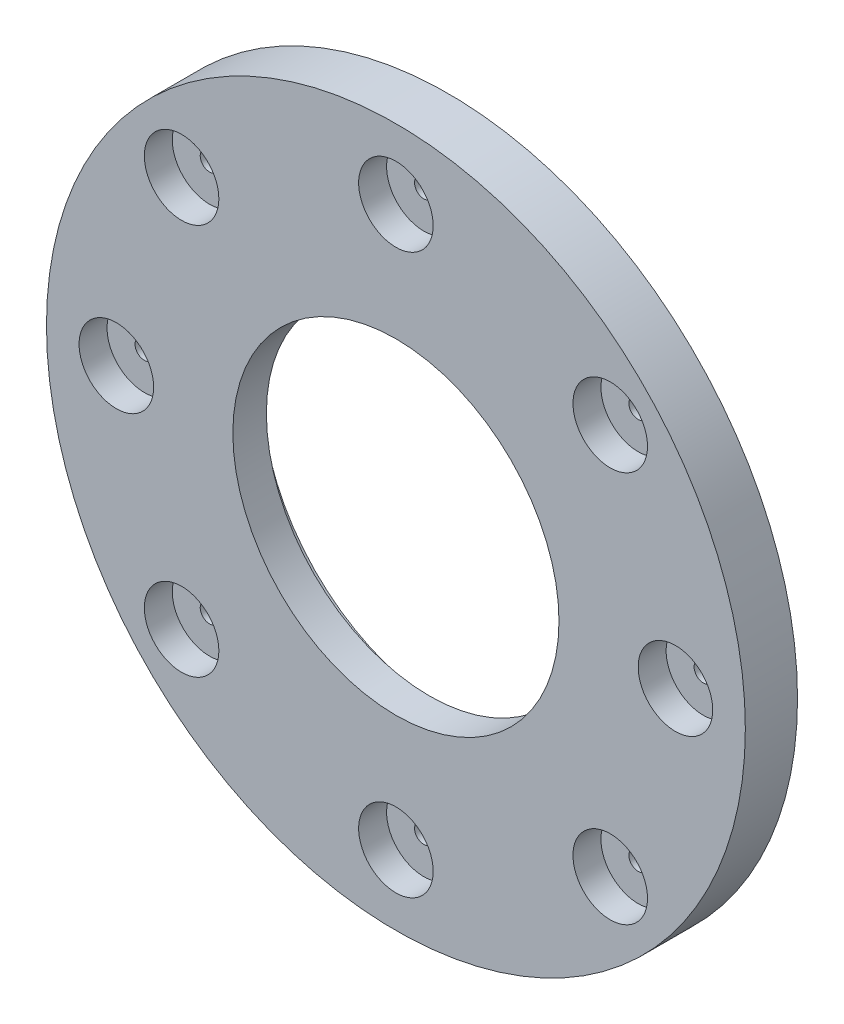
from build123d import *

# Parameters (mm, degrees)
SKETCH_1_R      = 37.5
SKETCH_1_R_2    = 20
SKETCH_1_R_3    = 1
EXTRUDE_1_DEPTH = 2
SKETCH_2_R      = 37.5
SKETCH_2_R_2    = 17.5
SKETCH_2_R_3    = 1
EXTRUDE_2_DEPTH = 0.6
SKETCH_3_R      = 37.5
SKETCH_3_R_2    = 17.5
SKETCH_3_R_3    = 4
EXTRUDE_3_DEPTH = 3


with BuildPart() as part:
    # Эскиз1 → Бобышка-Вытянуть1 (new body)
    with BuildSketch(Plane.XY):
        Circle(SKETCH_1_R)
        Circle(SKETCH_1_R_2, mode=Mode.SUBTRACT)
        with Locations((0, 30)):
            Circle(SKETCH_1_R_3, mode=Mode.SUBTRACT)
        with Locations((0, -30)):
            Circle(SKETCH_1_R_3, mode=Mode.SUBTRACT)
        with Locations((30, 0)):
            Circle(SKETCH_1_R_3, mode=Mode.SUBTRACT)
        with Locations((-30, 0)):
            Circle(SKETCH_1_R_3, mode=Mode.SUBTRACT)
        with Locations((23, 21)):
            Circle(SKETCH_1_R_3, mode=Mode.SUBTRACT)
        with Locations((-23, 21)):
            Circle(SKETCH_1_R_3, mode=Mode.SUBTRACT)
        with Locations((-23, -21)):
            Circle(SKETCH_1_R_3, mode=Mode.SUBTRACT)
        with Locations((23, -21)):
            Circle(SKETCH_1_R_3, mode=Mode.SUBTRACT)
    extrude(amount=EXTRUDE_1_DEPTH)

    # Эскиз2 → Бобышка-Вытянуть2 (add)
    with BuildSketch(Plane.XY.offset(2)):
        Circle(SKETCH_2_R)
        Circle(SKETCH_2_R_2, mode=Mode.SUBTRACT)
        with Locations((0, 30)):
            Circle(SKETCH_2_R_3, mode=Mode.SUBTRACT)
        with Locations((0, -30)):
            Circle(SKETCH_2_R_3, mode=Mode.SUBTRACT)
        with Locations((-30, 0)):
            Circle(SKETCH_2_R_3, mode=Mode.SUBTRACT)
        with Locations((30, 0)):
            Circle(SKETCH_2_R_3, mode=Mode.SUBTRACT)
        with Locations((-23, 21)):
            Circle(SKETCH_2_R_3, mode=Mode.SUBTRACT)
        with Locations((23, 21)):
            Circle(SKETCH_2_R_3, mode=Mode.SUBTRACT)
        with Locations((23, -21)):
            Circle(SKETCH_2_R_3, mode=Mode.SUBTRACT)
        with Locations((-23, -21)):
            Circle(SKETCH_2_R_3, mode=Mode.SUBTRACT)
    extrude(amount=EXTRUDE_2_DEPTH)

    # Эскиз3 → Бобышка-Вытянуть3 (add)
    with BuildSketch(Plane.XY.offset(2.6)):
        Circle(SKETCH_3_R)
        Circle(SKETCH_3_R_2, mode=Mode.SUBTRACT)
        with Locations((0, 30)):
            Circle(SKETCH_3_R_3, mode=Mode.SUBTRACT)
        with Locations((0, -30)):
            Circle(SKETCH_3_R_3, mode=Mode.SUBTRACT)
        with Locations((30, 0)):
            Circle(SKETCH_3_R_3, mode=Mode.SUBTRACT)
        with Locations((-30, 0)):
            Circle(SKETCH_3_R_3, mode=Mode.SUBTRACT)
        with Locations((23, 21)):
            Circle(SKETCH_3_R_3, mode=Mode.SUBTRACT)
        with Locations((-23, 21)):
            Circle(SKETCH_3_R_3, mode=Mode.SUBTRACT)
        with Locations((-23, -21)):
            Circle(SKETCH_3_R_3, mode=Mode.SUBTRACT)
        with Locations((23, -21)):
            Circle(SKETCH_3_R_3, mode=Mode.SUBTRACT)
    extrude(amount=EXTRUDE_3_DEPTH)


solid = part.part
